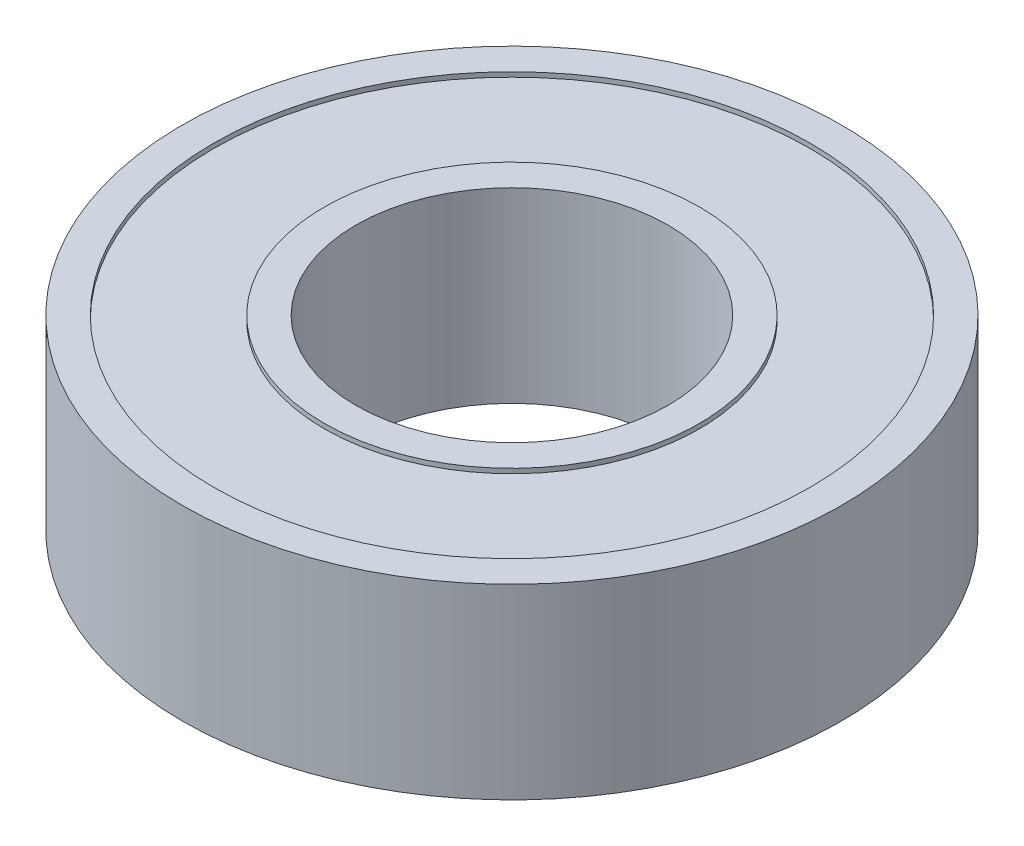
from build123d import *

# Parameters (mm, degrees)
SKETCH_1_R          = 21
SKETCH_1_R_2        = 9.95
EXTRUDE_1_DEPTH     = 5.95
SKETCH_2_R          = 19
SKETCH_2_R_2        = 11.95
CUT_EXTRUDE_1_DEPTH = 0.3


with BuildPart() as part:
    # Эскиз1 → Бобышка-Вытянуть1 (new, symmetric)
    with BuildSketch(Plane(origin=(0, 0, 0), x_dir=(1, 0, 0), z_dir=(0, 1, 0))):
        with Locations(Location((0, 0, 0), (0, 0, 270))):
            Circle(SKETCH_1_R)
        with Locations(Location((0, 0, 0), (0, 0, 270))):
            Circle(SKETCH_1_R_2, mode=Mode.SUBTRACT)
    extrude(amount=EXTRUDE_1_DEPTH, both=True)

    # Эскиз2 → Вырез-Вытянуть1 (cut)
    with BuildSketch(Plane(origin=(0, 5.95, 0), x_dir=(1, 0, 0), z_dir=(0, 1, 0))):
        with Locations(Location((0, 0, 0), (0, 0, 270))):
            Circle(SKETCH_2_R)
        with Locations(Location((0, 0, 0), (0, 0, 270))):
            Circle(SKETCH_2_R_2, mode=Mode.SUBTRACT)
    cut_extrude_1 = extrude(amount=-CUT_EXTRUDE_1_DEPTH, mode=Mode.SUBTRACT)

    # Зеркальное отражение1: Вырез-Вытянуть1 across plane
    add(cut_extrude_1.mirror(Plane.ZX), mode=Mode.SUBTRACT)


solid = part.part
